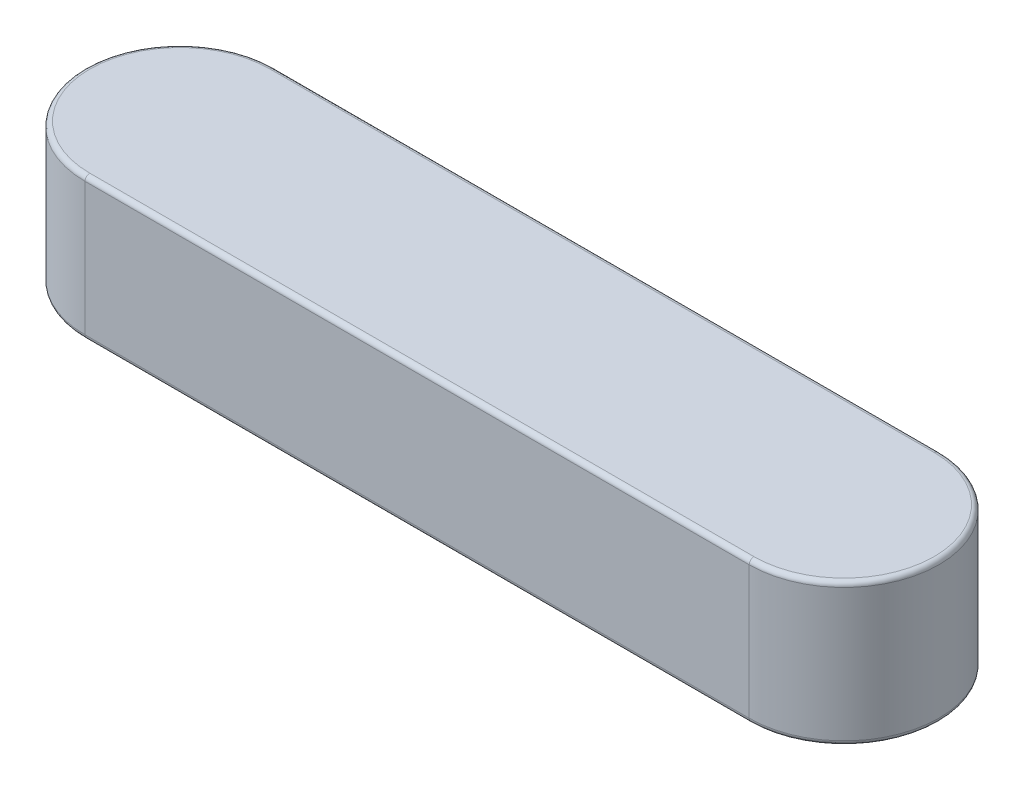
from build123d import *

# Parameters (mm, degrees)
BOSS_EXTRUDE1_DEPTH = 6
FILLET1_R           = 0.2


with BuildPart() as part:
    # Sketch1 → Boss-Extrude1 (new body)
    with BuildSketch(Plane(origin=(0, 0, 0), x_dir=(1, 0, 0), z_dir=(0, 1, 0))):
        with BuildLine():
            Line((-13.606134884, 4), (14.393865116, 4))
            ThreePointArc((14.393865116, 4), (18.393865116, 0), (14.393865116, -4))
            Line((14.393865116, -4), (-13.606134884, -4))
            ThreePointArc((-13.606134884, -4), (-17.606134884, 0), (-13.606134884, 4))
        make_face()
    extrude(amount=BOSS_EXTRUDE1_DEPTH)

    # Fillet1
    fillet1_edges = [part.edges().sort_by_distance(p)[0] for p in [
        (18.393865116, 6, 0),
        (0.393865116, 6, -4),
        (-17.606134884, 6, 0),
        (0.393865116, 0, -4),
        (18.393865116, 0, 0),
        (0.393865116, 0, 4),
        (-17.606134884, 0, 0),
        (0.393865116, 6, 4),
    ]]
    fillet(fillet1_edges, radius=FILLET1_R)


solid = part.part
